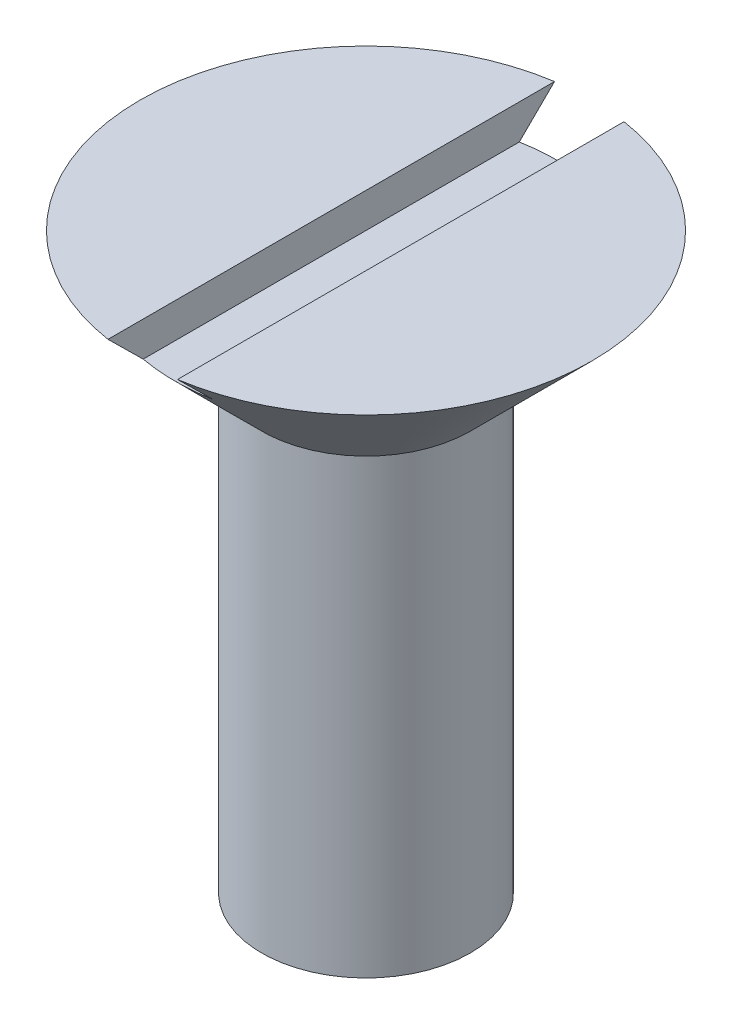
from build123d import *

# Parameters (mm, degrees)
SKETCH2_W          = 2
SKETCH2_H          = 2
CUT_EXTRUDE1_DEPTH = 43


with BuildPart() as part:
    # Sketch1 → Revolve1 (revolve)
    with BuildSketch(Plane.XY, mode=Mode.PRIVATE) as revolve1_sk:
        Polygon((0, 0), (6.5, 0), (3, -3.5), (3, -16.5), (0, -18.232050808), align=None)
    revolve(revolve1_sk.sketch.rotate(Axis((0, 0, 0), (0, -1, 0)), 180), axis=Axis((0, 0, 0), (0, -1, 0)))

    # Sketch2 → Cut-Extrude1 (cut, symmetric)
    with BuildSketch(Plane.XY):
        Rectangle(SKETCH2_W, SKETCH2_H)
    extrude(amount=CUT_EXTRUDE1_DEPTH, both=True, mode=Mode.SUBTRACT)


solid = part.part
